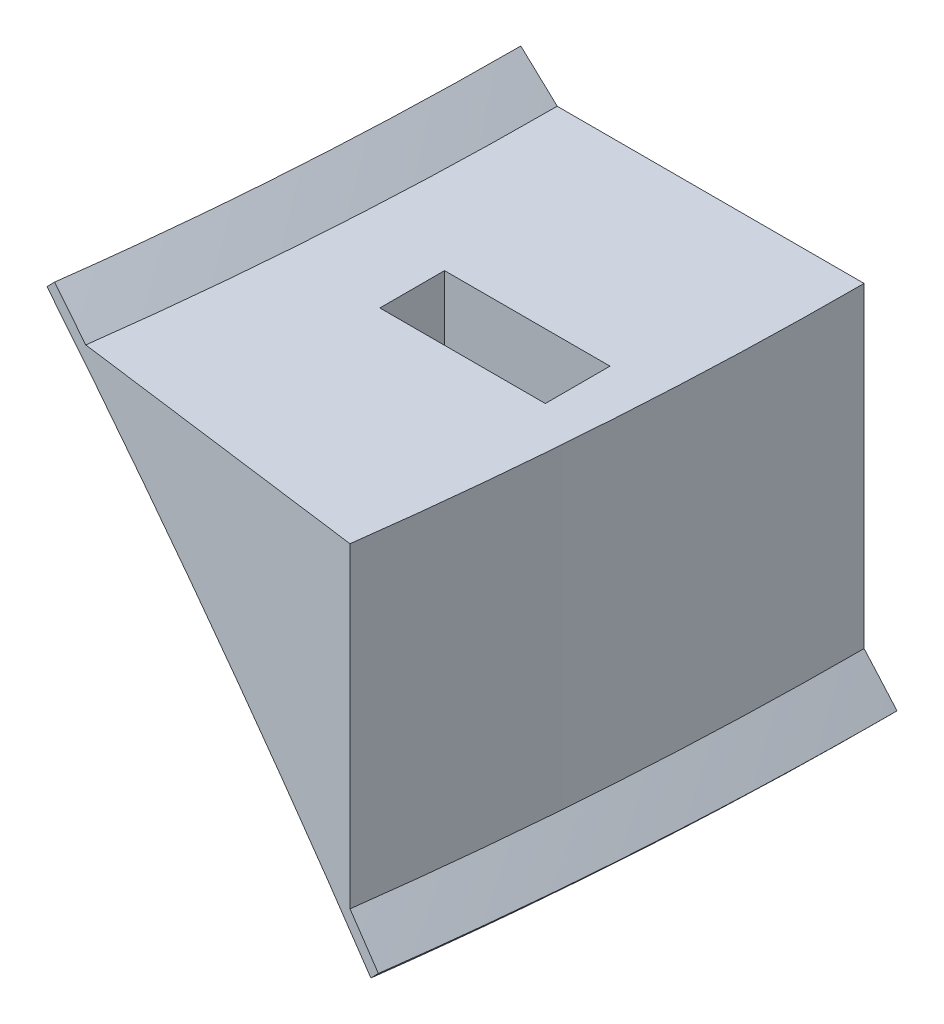
from build123d import *

# Parameters (mm, degrees)
REVOLVE2_ANGLE           = 7.5
SKETCH4_W                = 33.25
SKETCH4_H                = 13
CUT_EXTRUDE5_DEPTH       = 19
SKETCH7_W                = 33.25
SKETCH7_H                = 13
CUT_EXTRUDE7_DEPTH       = 19
CUT_EXTRUDE8_DEPTH       = 1799.499288206
CUT_EXTRUDE8_DEPTH_BACK  = 1799.499288206
SKETCH9_W                = 188.635889627
SKETCH9_H                = 632.041441351
CUT_EXTRUDE9_DEPTH       = 1799.499288206
CUT_EXTRUDE9_DEPTH_BACK  = 1799.499288206
SKETCH10_W               = 436.927860133
SKETCH10_H               = 1601.4752783
CUT_EXTRUDE10_DEPTH      = 143.403889156
CUT_EXTRUDE10_DEPTH_BACK = 143.403889156


with BuildPart() as part:
    # Sketch2 → Revolve2 (revolve)
    with BuildSketch(Plane.XY):
        with BuildLine():
            Line((0, 993.075249624), (0, 990.6))
            ThreePointArc((0, 990.6), (990.6, 0), (0, -990.6))
            Line((0, -990.6), (0, -993.075249624))
            ThreePointArc((0, -993.075249624), (357.30221933, -926.570869107), (666.748724276, -735.965073963))
            Line((666.748724276, -735.965073963), (742.973100692, -735.965073963))
            Line((742.973100692, -735.965073963), (742.973100692, -658.930514596))
            ThreePointArc((742.973100692, -658.930514596), (993.075236283, 0.162783709), (742.757038562, 659.174053709))
            Line((742.757038562, 659.174053709), (742.757038562, 722.715073963))
            Line((742.757038562, 722.715073963), (681.088374063, 722.715073963))
            ThreePointArc((681.088374063, 722.715073963), (366.393230651, 923.013787519), (0, 993.075249624))
        make_face()
    revolve(axis=Axis((0, 993.075249624, 0), (0, -1, 0)), revolution_arc=REVOLVE2_ANGLE)

    # Sketch4 → Cut-Extrude5 (cut)
    with BuildSketch(Plane.XZ.offset(735.965073963)):
        with Locations((705.258501449, 49.061390401)):
            Rectangle(SKETCH4_W, SKETCH4_H)
    extrude(amount=-CUT_EXTRUDE5_DEPTH, mode=Mode.SUBTRACT)

    # Sketch7 → Cut-Extrude7 (cut)
    with BuildSketch(Plane(origin=(0, 722.715073963, 0), x_dir=(-1, 0, 0), z_dir=(0, 1, 0))):
        with Locations((-714.999743141, 46.422731407)):
            Rectangle(SKETCH7_W, SKETCH7_H)
    extrude(amount=-CUT_EXTRUDE7_DEPTH, mode=Mode.SUBTRACT)

    # Sketch9 → Cut-Extrude8 (cut, two sides: drawn at the far end of the back side and taken through both)
    with BuildSketch(Plane(origin=(770.075395243, 627.042532096, 0), x_dir=(0, 0, -1), z_dir=(0.775445159402277, 0.6314149228198344, 0)).offset(-CUT_EXTRUDE8_DEPTH_BACK)):
        with Locations((-24.021749008, 516.225121034)):
            Rectangle(SKETCH9_W, SKETCH9_H)
    extrude(amount=CUT_EXTRUDE8_DEPTH + CUT_EXTRUDE8_DEPTH_BACK, mode=Mode.SUBTRACT)

    # Sketch10 → Cut-Extrude9 (cut, two sides: drawn at the far end of the back side and taken through both)
    with BuildSketch(Plane(origin=(770.075395243, 627.042532096, 0), x_dir=(0, 0, -1), z_dir=(0.775445159402277, 0.6314149228198344, 0)).offset(-CUT_EXTRUDE9_DEPTH_BACK)):
        with Locations((4.82975611, -781.418075933)):
            Rectangle(SKETCH10_W, SKETCH10_H)
    extrude(amount=CUT_EXTRUDE9_DEPTH + CUT_EXTRUDE9_DEPTH_BACK, mode=Mode.SUBTRACT)

    # Sketch12 → Cut-Extrude10 (cut, two sides: drawn at the far end of the back side and taken through both)
    with BuildSketch(Plane(origin=(700.633749088, 703.783206005, 0), x_dir=(0.7086907122814721, -0.7055192940848463, 0), z_dir=(0.7055192940848463, 0.7086907122814721, 0)).offset(-CUT_EXTRUDE10_DEPTH_BACK)):
        with BuildLine():
            Line((-41.294583605, -87.970897636), (-47.210429628, -112.285313767))
            Line((-47.210429628, -112.285313767), (-119.119874742, -100.128105701))
            Line((-119.119874742, -100.128105701), (-110.576768671, 17.662490687))
            Line((-110.576768671, 17.662490687), (-37.208423865, 15.148795667))
            Line((-37.208423865, 15.148795667), (-37.208423865, 0))
            add(Edge.make_bspline(
                [(-41.294583605, -87.970897636), (-39.934567915, -73.394235927), (-38.912646446, -58.753764388), (-37.549574236, -29.408857228), (-37.208423865, -14.704430952), (-37.208423865, 0)],
                knots=[0, 0, 0, 0, 0.5, 0.5, 1, 1, 1, 1], degree=3))
        make_face()
        with BuildLine():
            add(Edge.make_bspline(
                [(66.778461717, -97.878222384), (68.291902553, -81.657148428), (69.428925425, -65.367159938), (70.945475233, -32.718109498), (71.325001659, -16.35905716), (71.325001659, 0)],
                knots=[0, 0, 0, 0, 0.5, 0.5, 1, 1, 1, 1], degree=3))
            Line((71.325001659, 0), (71.325001659, 10.254449573))
            Line((71.325001659, 10.254449573), (98.450701035, 7.723597346))
            Line((98.450701035, 7.723597346), (86.999767635, -115.007620888))
            Line((86.999767635, -115.007620888), (65.180273381, -115.007620888))
            Line((65.180273381, -115.007620888), (66.778461717, -97.878222384))
        make_face()
    extrude(amount=CUT_EXTRUDE10_DEPTH + CUT_EXTRUDE10_DEPTH_BACK, mode=Mode.SUBTRACT)


solid = part.part
